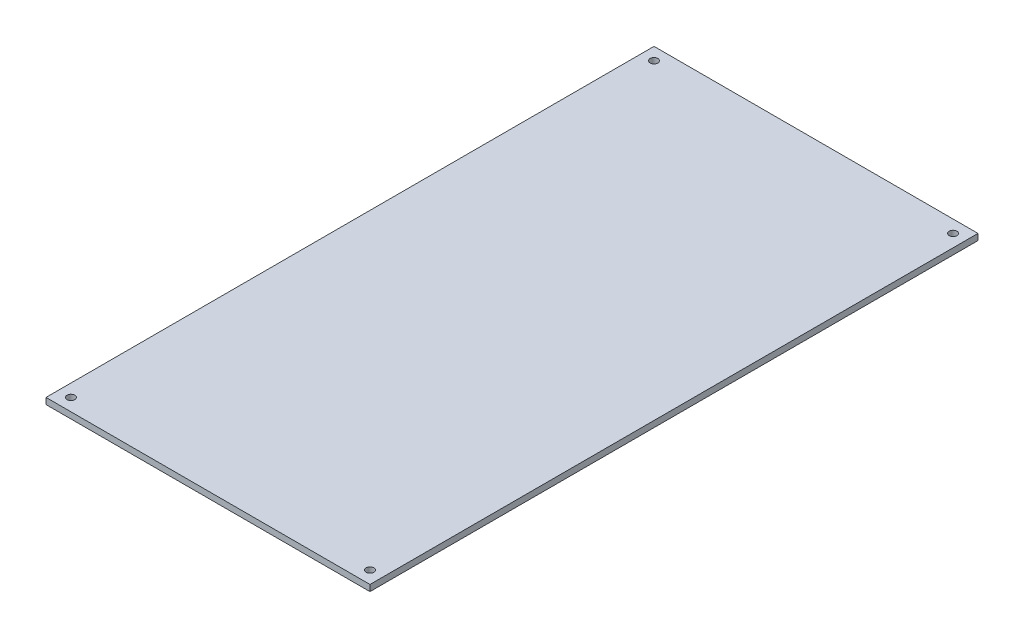
from build123d import *

# Parameters (mm, degrees)
SKETCH1_W           = 330.200000004
SKETCH1_H           = 619.700000498
SKETCH1_R           = 3.96875
BOSS_EXTRUDE1_DEPTH = 6.35


with BuildPart() as part:
    # Sketch1 → Boss-Extrude1 (new body)
    with BuildSketch(Plane(origin=(0, -91.897200465, 0), x_dir=(1, 0, 0), z_dir=(0, 1, 0))):
        with Locations((-634.09999992, 316.295249784)):
            Rectangle(SKETCH1_W, SKETCH1_H)
        with Locations(Location((-481.699999947, 613.44525004, 0), (0, 0, 270))):
            Circle(SKETCH1_R, mode=Mode.SUBTRACT)
        with Locations(Location((-786.499999947, 613.445250033, 0), (0, 0, 270))):
            Circle(SKETCH1_R, mode=Mode.SUBTRACT)
        with Locations(Location((-786.499999922, 19.145249535, 0), (0, 0, 270))):
            Circle(SKETCH1_R, mode=Mode.SUBTRACT)
        with Locations(Location((-481.699999918, 19.14525, 0), (0, 0, 270))):
            Circle(SKETCH1_R, mode=Mode.SUBTRACT)
    extrude(amount=BOSS_EXTRUDE1_DEPTH)


solid = part.part
